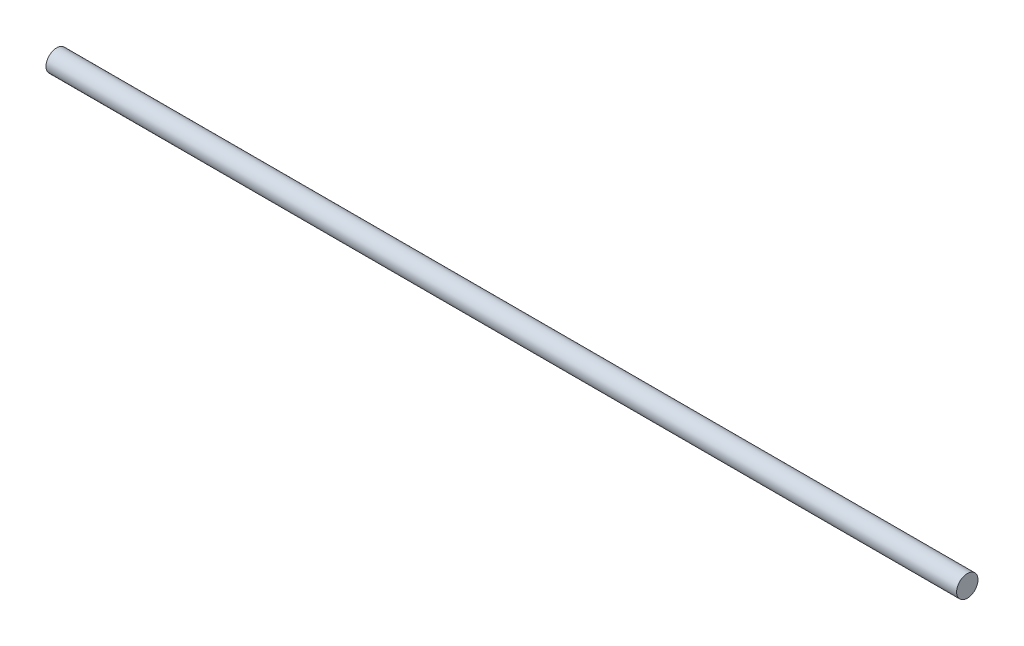
from build123d import *

# Parameters (mm, degrees)
SKETCH1_R           = 17.907
BOSS_EXTRUDE1_DEPTH = 762


with BuildPart() as part:
    # Sketch1 → Boss-Extrude1 (new, symmetric)
    with BuildSketch(Plane(origin=(0, 0, 0), x_dir=(0, 0, -1), z_dir=(1, 0, 0))):
        Circle(SKETCH1_R)
    extrude(amount=BOSS_EXTRUDE1_DEPTH, both=True)


solid = part.part
